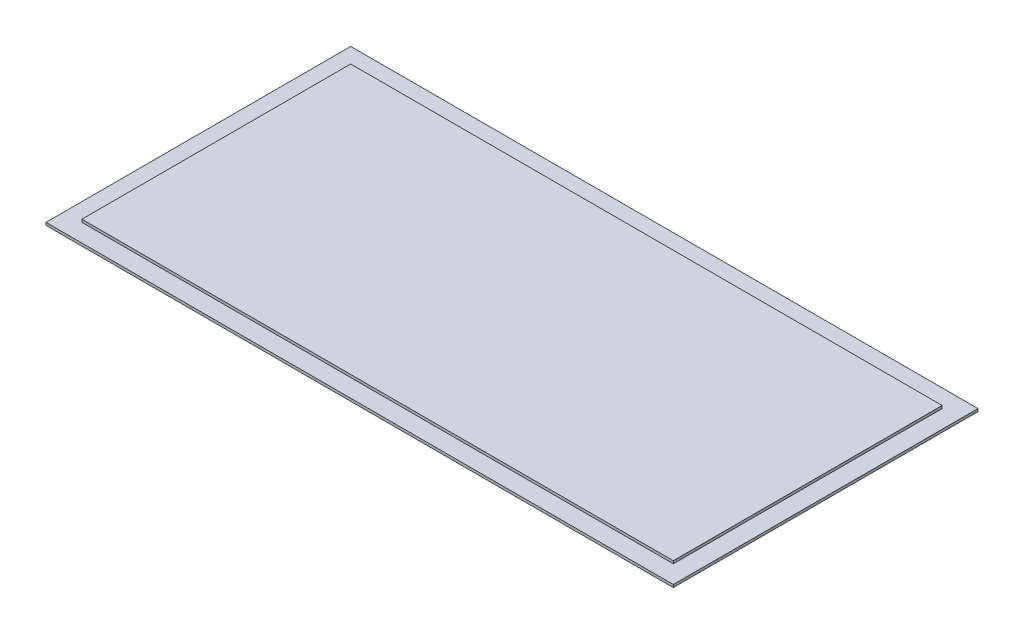
from build123d import *

# Parameters (mm, degrees)
SKETCH_1_W      = 700
SKETCH_1_H      = 340
EXTRUDE_1_DEPTH = 3
SKETCH_2_W      = 660
SKETCH_2_H      = 300
EXTRUDE_2_DEPTH = 3


with BuildPart() as part:
    # Эскиз1 → Бобышка-Вытянуть1 (new body)
    with BuildSketch(Plane(origin=(0, 0, 0), x_dir=(1, 0, 0), z_dir=(0, 1, 0))):
        Rectangle(SKETCH_1_W, SKETCH_1_H)
    extrude(amount=EXTRUDE_1_DEPTH)

    # Эскиз2 → Бобышка-Вытянуть2 (add)
    with BuildSketch(Plane(origin=(0, 3, 0), x_dir=(1, 0, 0), z_dir=(0, 1, 0))):
        Rectangle(SKETCH_2_W, SKETCH_2_H)
    extrude(amount=EXTRUDE_2_DEPTH)


solid = part.part
